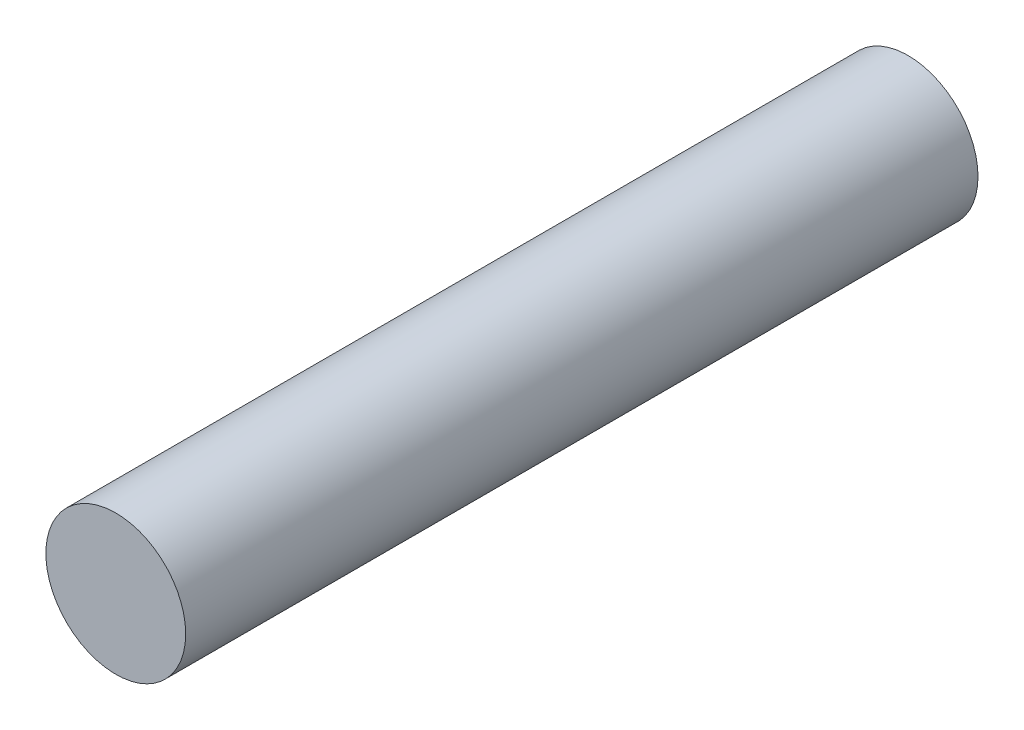
from build123d import *

# Parameters (mm, degrees)
SKETCH_1_R      = 1.5
EXTRUDE_1_DEPTH = 17


with BuildPart() as part:
    # 草图1 → 凸台-拉伸1 (new body)
    with BuildSketch(Plane.XY):
        Circle(SKETCH_1_R)
    extrude(amount=EXTRUDE_1_DEPTH)


solid = part.part
